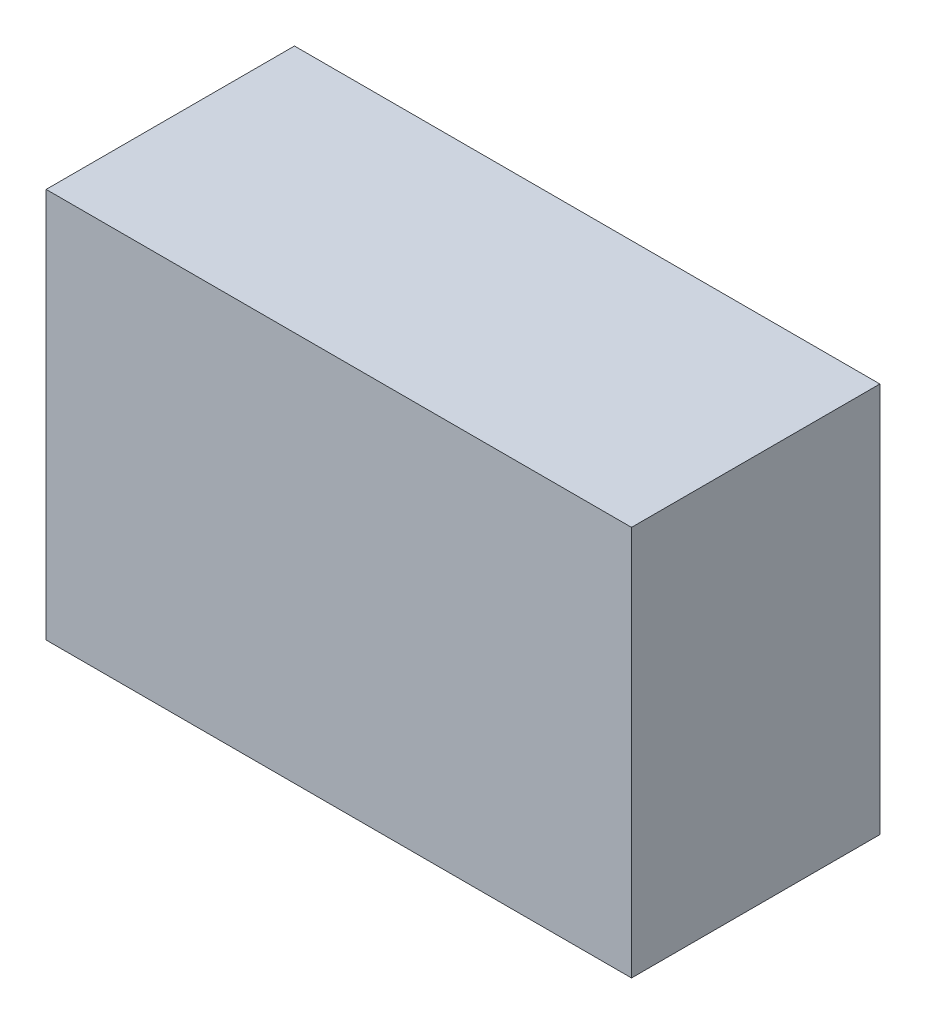
from build123d import *

# Parameters (mm, degrees)
SKETCH1_W           = 8.25
SKETCH1_H           = 5.5
BOSS_EXTRUDE1_DEPTH = 3.5


with BuildPart() as part:
    # Sketch1 → Boss-Extrude1 (new body)
    with BuildSketch(Plane.XY):
        with Locations((4.125, 2.75)):
            Rectangle(SKETCH1_W, SKETCH1_H)
    extrude(amount=BOSS_EXTRUDE1_DEPTH)


solid = part.part
